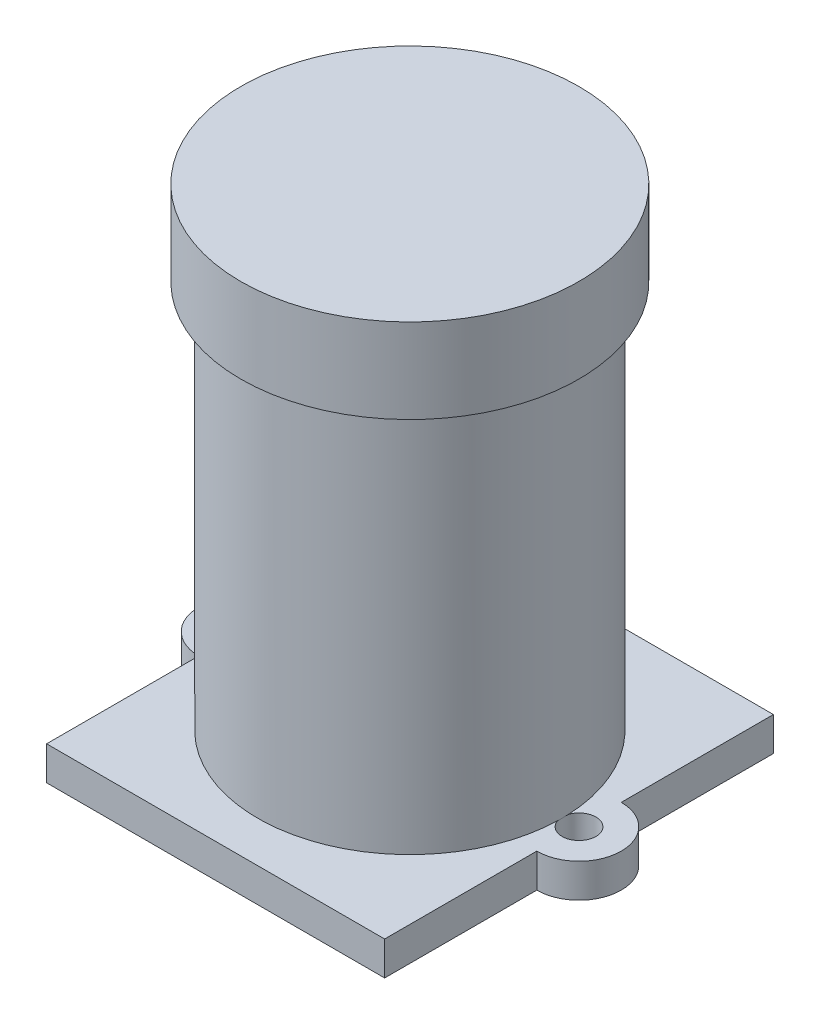
from build123d import *

# Parameters (mm, degrees)
EXTRUDE_1_DEPTH = 2
SKETCH_2_R      = 9
EXTRUDE_2_DEPTH = 23
SKETCH_4_R      = 10
EXTRUDE_3_DEPTH = 5


with BuildPart() as part:
    # 草图1 → 凸台-拉伸1 (new body)
    with BuildSketch(Plane(origin=(0, 0, 0), x_dir=(1, 0, 0), z_dir=(0, 1, 0))):
        with BuildLine():
            Line((17.5, -11.5), (2.5, -11.5))
            ThreePointArc((2.5, -11.5), (1.767766953, -13.267766953), (0, -14))
            Line((0, -14), (0, -23))
            Line((0, -23), (20, -23))
            Line((20, -23), (20, -14))
            ThreePointArc((20, -14), (18.232233047, -13.267766953), (17.5, -11.5))
        make_face()
        with BuildLine():
            ThreePointArc((0, -9), (1.767766953, -9.732233047), (2.5, -11.5))
            Line((2.5, -11.5), (17.5, -11.5))
            ThreePointArc((17.5, -11.5), (18.232233047, -9.732233047), (20, -9))
            Line((20, -9), (20, 0))
            Line((20, 0), (0, 0))
            Line((0, 0), (0, -9))
        make_face()
        with BuildLine():
            ThreePointArc((0, -10.5), (0.707106781, -10.792893219), (1, -11.5))
            Line((1, -11.5), (2.5, -11.5))
            ThreePointArc((2.5, -11.5), (1.767766953, -9.732233047), (0, -9))
            Line((0, -9), (0, -10.5))
        make_face()
        with BuildLine():
            Line((2.5, -11.5), (1, -11.5))
            ThreePointArc((1, -11.5), (0.707106781, -12.207106781), (0, -12.5))
            Line((0, -12.5), (0, -14))
            ThreePointArc((0, -14), (1.767766953, -13.267766953), (2.5, -11.5))
        make_face()
        with BuildLine():
            ThreePointArc((0, -12.5), (-1, -11.5), (0, -10.5))
            Line((0, -10.5), (0, -9))
            ThreePointArc((0, -9), (-2.5, -11.5), (0, -14))
            Line((0, -14), (0, -12.5))
        make_face()
        with BuildLine():
            ThreePointArc((20, -9), (18.232233047, -9.732233047), (17.5, -11.5))
            Line((17.5, -11.5), (19, -11.5))
            ThreePointArc((19, -11.5), (19.292893219, -10.792893219), (20, -10.5))
            Line((20, -10.5), (20, -9))
        make_face()
        with BuildLine():
            Line((19, -11.5), (17.5, -11.5))
            ThreePointArc((17.5, -11.5), (18.232233047, -13.267766953), (20, -14))
            Line((20, -14), (20, -12.5))
            ThreePointArc((20, -12.5), (19.292893219, -12.207106781), (19, -11.5))
        make_face()
        with BuildLine():
            ThreePointArc((22.5, -11.5), (21.767766953, -9.732233047), (20, -9))
            Line((20, -9), (20, -10.5))
            ThreePointArc((20, -10.5), (20.707106781, -10.792893219), (21, -11.5))
            ThreePointArc((21, -11.5), (20.707106781, -12.207106781), (20, -12.5))
            Line((20, -12.5), (20, -14))
            ThreePointArc((20, -14), (21.767766953, -13.267766953), (22.5, -11.5))
        make_face()
    extrude(amount=EXTRUDE_1_DEPTH)

    # 草图2 → 凸台-拉伸2 (add)
    with BuildSketch(Plane(origin=(0, 2, 0), x_dir=(1, 0, 0), z_dir=(0, 1, 0))):
        with Locations(Location((10.062202952, -11.571533395, 0), (0, 0, 2.511658154))):
            Circle(SKETCH_2_R)
    extrude(amount=EXTRUDE_2_DEPTH)

    # 草图4 → 凸台-拉伸3 (add)
    with BuildSketch(Plane(origin=(0, 25, 0), x_dir=(1, 0, 0), z_dir=(0, 1, 0))):
        with Locations(Location((10.062202952, -11.571533395, 0), (0, 0, 270))):
            Circle(SKETCH_4_R)
    extrude(amount=EXTRUDE_3_DEPTH)


solid = part.part
